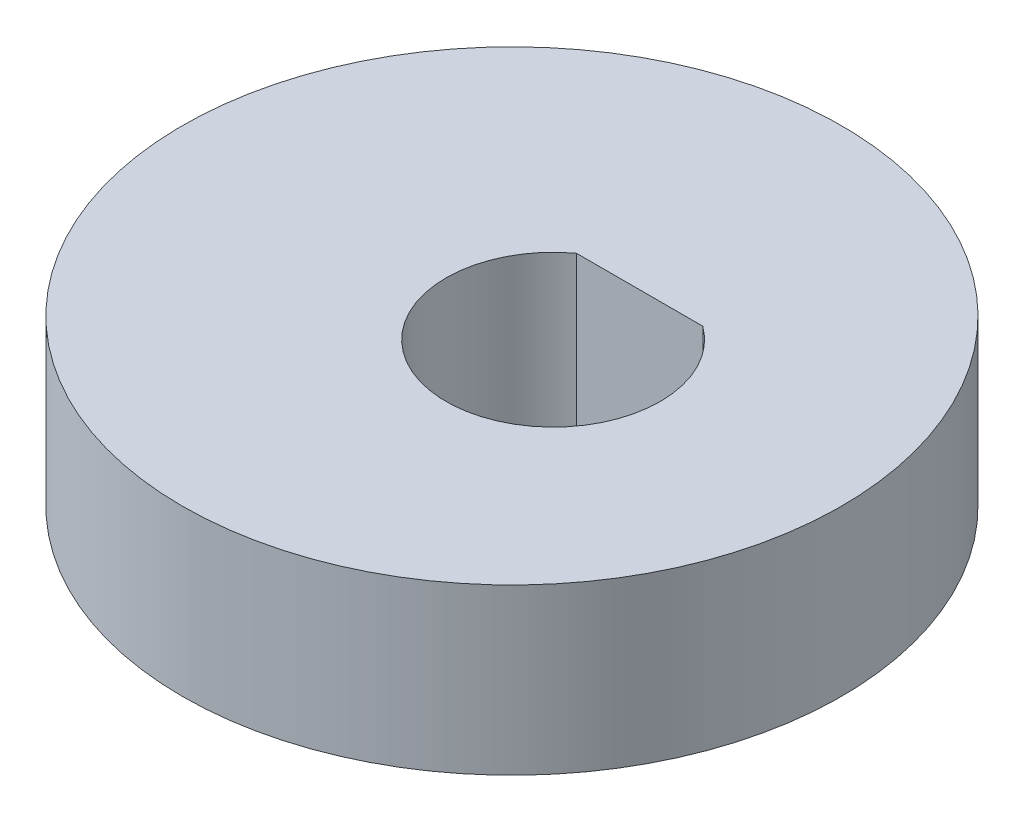
from build123d import *

# Parameters (mm, degrees)
SKETCH1_R           = 8
BOSS_EXTRUDE1_DEPTH = 4


with BuildPart() as part:
    # Sketch1 → Boss-Extrude1 (new body)
    with BuildSketch(Plane(origin=(0, 0, 0), x_dir=(1, 0, 0), z_dir=(0, 1, 0))):
        with Locations(Location((0, 0, 0), (0, 0, 270))):
            Circle(SKETCH1_R)
        with BuildLine():
            Line((-0.532970972, 2.1), (2.532970972, 2.1))
            ThreePointArc((2.532970972, 2.1), (1, -2.6), (-0.532970972, 2.1))
        make_face(mode=Mode.SUBTRACT)
    extrude(amount=BOSS_EXTRUDE1_DEPTH)


solid = part.part
